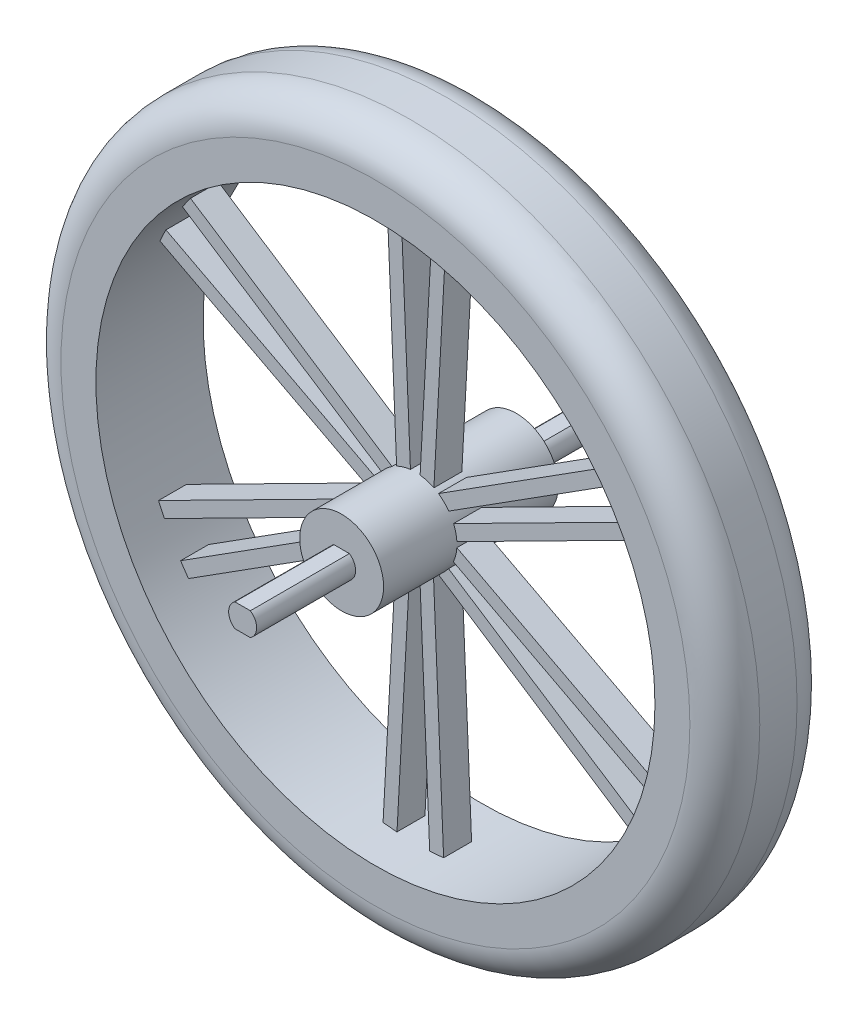
from build123d import *

# Parameters (mm, degrees)
SKETCH1_R           = 18
BOSS_EXTRUDE1_DEPTH = 37.5
SKETCH2_R           = 150
SKETCH2_R_2         = 120
BOSS_EXTRUDE2_DEPTH = 23
BOSS_EXTRUDE3_DEPTH = 6
CIRPATTERN15_COUNT  = 6
FILLET1_R           = 15
BOSS_EXTRUDE4_DEPTH = 42.5


with BuildPart() as part:
    # Sketch1 → Boss-Extrude1 (new, symmetric)
    with BuildSketch(Plane.XY):
        Circle(SKETCH1_R)
    extrude(amount=BOSS_EXTRUDE1_DEPTH, both=True)



with BuildPart() as body_2:
    # Sketch2 → Boss-Extrude2 (new, symmetric)
    with BuildSketch(Plane.XY):
        Circle(SKETCH2_R)
        Circle(SKETCH2_R_2, mode=Mode.SUBTRACT)
    extrude(amount=BOSS_EXTRUDE2_DEPTH, both=True)


with BuildPart() as part_1:
    add(part.part)

    add(body_2.part)  # Boss-Extrude3 merges body 2
    # Sketch3 → Boss-Extrude3 (add, symmetric)
    with BuildSketch(Plane.XY):
        with BuildLine():
            Line((-6.292975555, 119.834879975), (-1.969902622, 17.891883178))
            ThreePointArc((-1.969902622, 17.891883178), (-5.010440879, 17.288593991), (-7.902385067, 16.172578961))
            Line((-7.902385067, 16.172578961), (-12.278660753, 119.370157452))
            ThreePointArc((-12.278660753, 119.370157452), (-9.288724915, 119.639958164), (-6.292975555, 119.834879975))
        make_face()
        with BuildLine():
            Line((13.720864234, 119.212993774), (8.097322617, 16.075862852))
            ThreePointArc((8.097322617, 16.075862852), (5.2190816, 17.226757886), (2.18605888, 17.866760942))
            Line((2.18605888, 17.866760942), (7.741234625, 119.750045037))
            ThreePointArc((7.741234625, 119.750045037), (10.734408595, 119.51892098), (13.720864234, 119.212993774))
        make_face()
    boss_extrude3 = extrude(amount=BOSS_EXTRUDE3_DEPTH, both=True)

    # CirPattern15: Boss-Extrude3 ×6 about axis
    cirpattern15_axis = Axis((0, 0, -53.35), (0, 0, 1))
    for i in range(1, CIRPATTERN15_COUNT):
        add(boss_extrude3.rotate(cirpattern15_axis, i * 360 / CIRPATTERN15_COUNT))

    # Fillet1
    fillet1_edges = [part_1.edges().sort_by_distance(p)[0] for p in [
        (-150, 0, -23),
        (-150, 0, 23),
    ]]
    fillet(fillet1_edges, radius=FILLET1_R)

    # Sketch5 → Boss-Extrude4 (add)
    with BuildSketch(Plane.XY.offset(37.5)):
        with BuildLine():
            Line((-3.31662479, 5), (3.31662479, 5))
            ThreePointArc((3.31662479, 5), (6, 0), (3.31662479, -5))
            Line((3.31662479, -5), (-3.31662479, -5))
            ThreePointArc((-3.31662479, -5), (-6, 0), (-3.31662479, 5))
        make_face()
    boss_extrude4 = extrude(amount=BOSS_EXTRUDE4_DEPTH)

    # Mirror1: Boss-Extrude4 across plane
    add(boss_extrude4.mirror(Plane.XY))


solid = part_1.part
